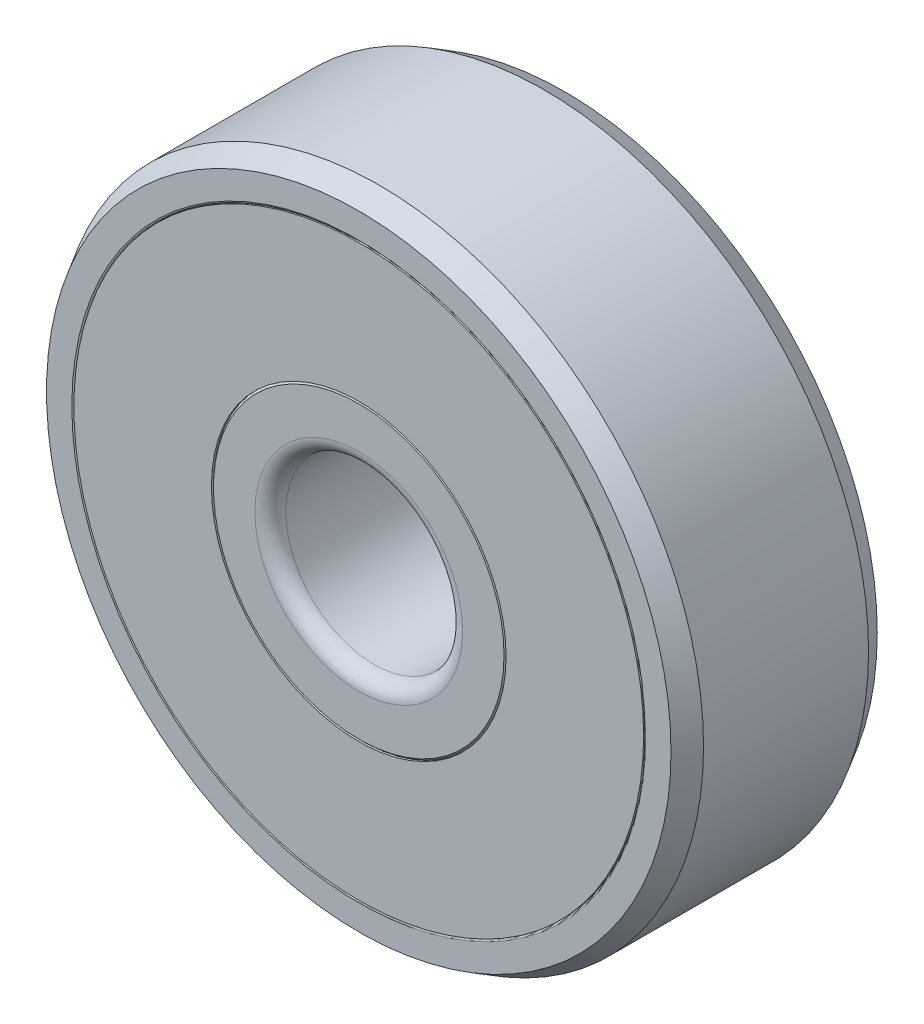
from build123d import *

# Parameters (mm, degrees)
SKETCH4_W         = 0.208333333
SKETCH4_H         = 4.666666667
CIRPATTERN1_COUNT = 7


with BuildPart() as part:
    # Sketch3 → Revolve1 (revolve)
    with BuildSketch(Plane(origin=(0, 0, 0), x_dir=(0, 0, -1), z_dir=(1, 0, 0)), mode=Mode.PRIVATE) as revolve1_sk:
        with BuildLine():
            Line((-2.8, -11), (2.8, -11))
            Line((2.8, -11), (3.5, -10.595854812))
            Line((3.5, -10.595854812), (3.5, -9.736666667))
            ThreePointArc((3.5, -9.736666667), (3.479497475, -9.687169192), (3.43, -9.666666667))
            Line((3.43, -9.666666667), (2.222222222, -9.666666667))
            ThreePointArc((2.222222222, -9.666666667), (0, -10.555555556), (-2.222222222, -9.666666667))
            Line((-2.222222222, -9.666666667), (-3.43, -9.666666667))
            ThreePointArc((-3.43, -9.666666667), (-3.479497475, -9.687169192), (-3.5, -9.736666667))
            Line((-3.5, -9.736666667), (-3.5, -10.595854812))
            Line((-3.5, -10.595854812), (-2.8, -11))
        make_face()
        with BuildLine():
            Line((-2.975, -3), (2.975, -3))
            ThreePointArc((2.975, -3), (3.34623106, -3.15376894), (3.5, -3.525))
            Line((3.5, -3.525), (3.5, -4.93))
            Line((3.5, -4.93), (3.43, -5))
            Line((3.43, -5), (2.222222222, -5))
            ThreePointArc((2.222222222, -5), (0, -4.111111111), (-2.222222222, -5))
            Line((-2.222222222, -5), (-3.43, -5))
            Line((-3.43, -5), (-3.5, -4.93))
            Line((-3.5, -4.93), (-3.5, -3.525))
            ThreePointArc((-3.5, -3.525), (-3.34623106, -3.15376894), (-2.975, -3))
        make_face()
    revolve(revolve1_sk.sketch.rotate(Axis((0, 0, 3.5), (0, 0, -1)), 270), axis=Axis((0, 0, 3.5), (0, 0, -1)))


with BuildPart() as body_2:
    # Sketch4 → Revolve2 (revolve)
    with BuildSketch(Plane(origin=(0, 0, 0), x_dir=(0, 0, -1), z_dir=(1, 0, 0)), mode=Mode.PRIVATE) as revolve2_sk:
        with Locations((-3.395833334, -7.333333334)):
            Rectangle(SKETCH4_W, SKETCH4_H)
    revolve(revolve2_sk.sketch.rotate(Axis((0, 0, 3.5), (0, 0, -1)), 270), axis=Axis((0, 0, 3.5), (0, 0, -1)))


with BuildPart() as body_3:
    # Sketch5 → Revolve3 (revolve)
    with BuildSketch(Plane(origin=(0, 0, 0), x_dir=(0, 0, -1), z_dir=(1, 0, 0))):
        with BuildLine():
            Line((0, -4.111111111), (0, -10.555555556))
            ThreePointArc((0, -10.555555556), (-3.222222222, -7.333333333), (0, -4.111111111))
        make_face()
    revolve(axis=Axis((0, 0, 0), (0, -1, 0)))


with BuildPart() as cirpattern1_1:
    # CirPattern1: pattern copy
    add(body_3.part.rotate(Axis((0, 0, 0), (0, 0, 1)), 1 * 360 / CIRPATTERN1_COUNT))


with BuildPart() as cirpattern1_2:
    # CirPattern1: pattern copy
    add(body_3.part.rotate(Axis((0, 0, 0), (0, 0, 1)), 2 * 360 / CIRPATTERN1_COUNT))


with BuildPart() as cirpattern1_3:
    # CirPattern1: pattern copy
    add(body_3.part.rotate(Axis((0, 0, 0), (0, 0, 1)), 3 * 360 / CIRPATTERN1_COUNT))


with BuildPart() as cirpattern1_4:
    # CirPattern1: pattern copy
    add(body_3.part.rotate(Axis((0, 0, 0), (0, 0, 1)), 4 * 360 / CIRPATTERN1_COUNT))


with BuildPart() as cirpattern1_5:
    # CirPattern1: pattern copy
    add(body_3.part.rotate(Axis((0, 0, 0), (0, 0, 1)), 5 * 360 / CIRPATTERN1_COUNT))


with BuildPart() as cirpattern1_6:
    # CirPattern1: pattern copy
    add(body_3.part.rotate(Axis((0, 0, 0), (0, 0, 1)), 6 * 360 / CIRPATTERN1_COUNT))


solid = Compound([part.part, body_2.part, body_3.part, cirpattern1_1.part, cirpattern1_2.part, cirpattern1_3.part, cirpattern1_4.part, cirpattern1_5.part, cirpattern1_6.part])
